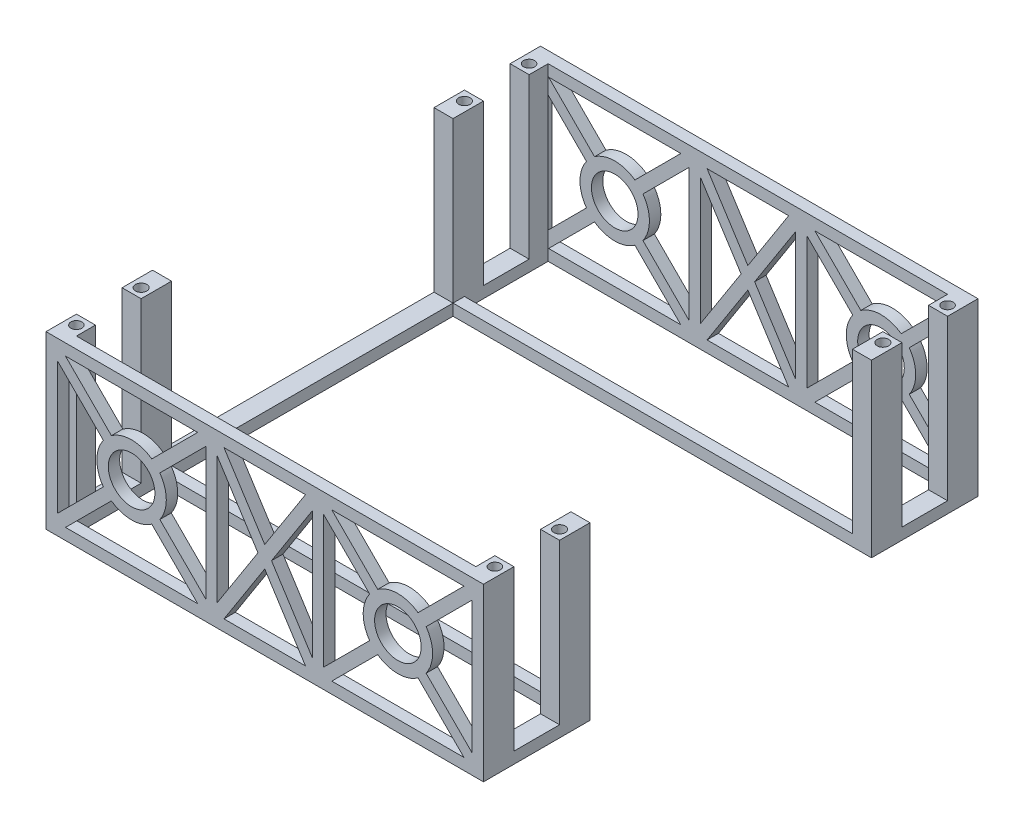
from build123d import *

# Parameters (mm, degrees)
SKETCH1_W           = 115
SKETCH1_H           = 45
SKETCH1_R           = 6.125
BOSS_EXTRUDE1_DEPTH = 3
SKETCH2_W           = 5
SKETCH2_H           = 45
BOSS_EXTRUDE2_DEPTH = 5
SKETCH3_R           = 1.45
CUT_EXTRUDE1_DEPTH  = 97.276078541
SKETCH4_W           = 5
SKETCH4_H           = 3
BOSS_EXTRUDE3_DEPTH = 122
BOSS_EXTRUDE5_DEPTH = 3
SKETCH8_W           = 5
SKETCH8_H           = 3
BOSS_EXTRUDE6_DEPTH = 12
SKETCH9_W           = 5
SKETCH9_H           = 3
BOSS_EXTRUDE7_DEPTH = 12
SKETCH10_W          = 5
SKETCH10_H          = 3
SKETCH10_H_2        = 5
BOSS_EXTRUDE8_DEPTH = 41.999995
SKETCH13_R          = 1.5
CUT_EXTRUDE3_DEPTH  = 160.289306921


with BuildPart() as part:
    # Sketch1 → Boss-Extrude1 (new body)
    with BuildSketch(Plane.XY):
        with Locations((-27.46518875, -74.528475384)):
            Rectangle(SKETCH1_W, SKETCH1_H)
        Polygon((-16.746917184, -94.028475384), (-38.183460316, -94.028475384), (-27.46518875, -77.307971742), align=None, mode=Mode.SUBTRACT)
        Polygon((-14.96518875, -57.807971742), (-14.96518875, -91.248979027), (-25.683460316, -74.528475384), align=None, mode=Mode.SUBTRACT)
        Polygon((-38.183460316, -55.028475384), (-16.746917184, -55.028475384), (-27.46518875, -71.748979027), align=None, mode=Mode.SUBTRACT)
        Polygon((-39.96518875, -91.248979027), (-39.96518875, -57.807971742), (-29.246917184, -74.528475384), align=None, mode=Mode.SUBTRACT)
        with BuildLine():
            Line((-11.96518875, -91.907155041), (-11.96518875, -57.149795728))
            Line((-11.96518875, -57.149795728), (0.109576269, -69.224560747))
            ThreePointArc((0.109576269, -69.224560747), (-1.59018875, -74.528475384), (0.109576269, -79.832390022))
            Line((0.109576269, -79.832390022), (-11.96518875, -91.907155041))
        make_face(mode=Mode.SUBTRACT)
        with BuildLine():
            Line((-9.843868406, -55.028475384), (24.913490906, -55.028475384))
            Line((24.913490906, -55.028475384), (12.838725887, -67.103240403))
            ThreePointArc((12.838725887, -67.103240403), (7.53481125, -65.403475384), (2.230896613, -67.103240403))
            Line((2.230896613, -67.103240403), (-9.843868406, -55.028475384))
        make_face(mode=Mode.SUBTRACT)
        with BuildLine():
            Line((27.03481125, -57.149795728), (27.03481125, -91.907155041))
            Line((27.03481125, -91.907155041), (14.960046231, -79.832390022))
            ThreePointArc((14.960046231, -79.832390022), (16.65981125, -74.528475384), (14.960046231, -69.224560747))
            Line((14.960046231, -69.224560747), (27.03481125, -57.149795728))
        make_face(mode=Mode.SUBTRACT)
        with BuildLine():
            Line((12.838725887, -81.953710365), (24.913490906, -94.028475384))
            Line((24.913490906, -94.028475384), (-9.843868406, -94.028475384))
            Line((-9.843868406, -94.028475384), (2.230896613, -81.953710365))
            ThreePointArc((2.230896613, -81.953710365), (7.53481125, -83.653475384), (12.838725887, -81.953710365))
        make_face(mode=Mode.SUBTRACT)
        with BuildLine():
            Line((-81.96518875, -91.907155041), (-81.96518875, -57.149795728))
            Line((-81.96518875, -57.149795728), (-69.890423731, -69.224560747))
            ThreePointArc((-69.890423731, -69.224560747), (-71.59018875, -74.528475384), (-69.890423731, -79.832390022))
            Line((-69.890423731, -79.832390022), (-81.96518875, -91.907155041))
        make_face(mode=Mode.SUBTRACT)
        with BuildLine():
            Line((-79.843868406, -55.028475384), (-45.086509094, -55.028475384))
            Line((-45.086509094, -55.028475384), (-57.161274113, -67.103240403))
            ThreePointArc((-57.161274113, -67.103240403), (-62.46518875, -65.403475384), (-67.769103387, -67.103240403))
            Line((-67.769103387, -67.103240403), (-79.843868406, -55.028475384))
        make_face(mode=Mode.SUBTRACT)
        with BuildLine():
            Line((-42.96518875, -57.149795728), (-42.96518875, -91.907155041))
            Line((-42.96518875, -91.907155041), (-55.039953769, -79.832390022))
            ThreePointArc((-55.039953769, -79.832390022), (-53.34018875, -74.528475384), (-55.039953769, -69.224560747))
            Line((-55.039953769, -69.224560747), (-42.96518875, -57.149795728))
        make_face(mode=Mode.SUBTRACT)
        with BuildLine():
            Line((-45.086509094, -94.028475384), (-79.843868406, -94.028475384))
            Line((-79.843868406, -94.028475384), (-67.769103387, -81.953710365))
            ThreePointArc((-67.769103387, -81.953710365), (-62.46518875, -83.653475384), (-57.161274113, -81.953710365))
            Line((-57.161274113, -81.953710365), (-45.086509094, -94.028475384))
        make_face(mode=Mode.SUBTRACT)
        with Locations((-62.46518875, -74.528475384)):
            Circle(SKETCH1_R, mode=Mode.SUBTRACT)
        with Locations((7.53481125, -74.528475384)):
            Circle(SKETCH1_R, mode=Mode.SUBTRACT)
    boss_extrude1 = extrude(amount=BOSS_EXTRUDE1_DEPTH)

    # Sketch2 → Boss-Extrude2 (add)
    with BuildSketch(Plane(origin=(0, 0, 0), x_dir=(-1, 0, 0), z_dir=(0, 0, -1))):
        with Locations((-27.53481125, -74.528475384)):
            Rectangle(SKETCH2_W, SKETCH2_H)
        with Locations((82.46518875, -74.528475384)):
            Rectangle(SKETCH2_W, SKETCH2_H)
    boss_extrude2 = extrude(amount=BOSS_EXTRUDE2_DEPTH)

    # Sketch3 → Cut-Extrude1 (cut, through all)
    with BuildSketch(Plane(origin=(0, -52.028475384, 0), x_dir=(1, 0, 0), z_dir=(0, 1, 0))):
        with Locations(Location((-82.46518875, 2.5, 0), (0, 0, 180))):
            Circle(SKETCH3_R)
        with Locations(Location((27.53481125, 2.5, 0), (0, 0, 180))):
            Circle(SKETCH3_R)
    cut_extrude1 = extrude(amount=-CUT_EXTRUDE1_DEPTH, mode=Mode.SUBTRACT)

    # Sketch4 → Boss-Extrude3 (add)
    with BuildSketch(Plane(origin=(0, 0, -5), x_dir=(-1, 0, 0), z_dir=(0, 0, -1))):
        with Locations((82.46518875, -95.528475384)):
            Rectangle(SKETCH4_W, SKETCH4_H)
    extrude(amount=BOSS_EXTRUDE3_DEPTH)

    # Mirror3: Boss-Extrude1, Boss-Extrude2, Cut-Extrude1 across plane
    add(boss_extrude1.mirror(Plane(origin=(0, 0, -62), x_dir=(1, 0, 0), z_dir=(0, 0, -1))))
    add(boss_extrude2.mirror(Plane(origin=(0, 0, -62), x_dir=(1, 0, 0), z_dir=(0, 0, -1))))
    add(cut_extrude1.mirror(Plane(origin=(0, 0, -62), x_dir=(1, 0, 0), z_dir=(0, 0, -1))), mode=Mode.SUBTRACT)

    # Sketch7 → Boss-Extrude5 (add)
    with BuildSketch(Plane(origin=(0, -97.028475384, 0), x_dir=(-1, 0, 0), z_dir=(0, -1, 0))):
        Polygon((-30.03481125, 25), (-30.03481125, 17), (-25.03481125, 17), (-25.03481125, 22), (79.96518875, 22), (79.96518875, 17), (84.96518875, 17), (84.96518875, 25), align=None)
        Polygon((79.96518875, 107), (79.96518875, 102), (-25.03481125, 102), (-25.03481125, 107), (-30.03481125, 107), (-30.03481125, 99), (84.96518875, 99), (84.96518875, 107), align=None)
    extrude(amount=-BOSS_EXTRUDE5_DEPTH)

    # Sketch8 → Boss-Extrude6 (add)
    with BuildSketch(Plane.XY.offset(-17)):
        with Locations((27.53481125, -95.528475384)):
            Rectangle(SKETCH8_W, SKETCH8_H)
    extrude(amount=BOSS_EXTRUDE6_DEPTH)

    # Sketch9 → Boss-Extrude7 (add)
    with BuildSketch(Plane(origin=(0, 0, -107), x_dir=(-1, 0, 0), z_dir=(0, 0, -1))):
        with Locations((-27.53481125, -95.528475384)):
            Rectangle(SKETCH9_W, SKETCH9_H)
    extrude(amount=BOSS_EXTRUDE7_DEPTH)

    # Sketch10 → Boss-Extrude8 (add)
    with BuildSketch(Plane(origin=(0, -94.028475384, 0), x_dir=(1, 0, 0), z_dir=(0, 1, 0))):
        with Locations((-82.46518875, 100.5)):
            Rectangle(SKETCH10_W, SKETCH10_H)
        with Locations((-82.46518875, 104.5)):
            Rectangle(SKETCH10_W, SKETCH10_H_2)
        with Locations((-82.46518875, 23.5)):
            Rectangle(SKETCH10_W, SKETCH10_H)
        with Locations((-82.46518875, 19.5)):
            Rectangle(SKETCH10_W, SKETCH10_H_2)
        with Locations((27.53481125, 23.5)):
            Rectangle(SKETCH10_W, SKETCH10_H)
        with Locations((27.53481125, 19.5)):
            Rectangle(SKETCH10_W, SKETCH10_H_2)
        with Locations((27.53481125, 104.5)):
            Rectangle(SKETCH10_W, SKETCH10_H_2)
        with Locations((27.53481125, 100.5)):
            Rectangle(SKETCH10_W, SKETCH10_H)
    extrude(amount=BOSS_EXTRUDE8_DEPTH)

    # Sketch13 → Cut-Extrude3 (cut, through all)
    with BuildSketch(Plane(origin=(0, -52.028475384, 0), x_dir=(1, 0, 0), z_dir=(0, 1, 0))):
        with Locations(Location((27.53481125, 19.5, 0), (0, 0, 270))):
            Circle(SKETCH13_R)
        with Locations(Location((27.53481125, 104.5, 0), (0, 0, 270))):
            Circle(SKETCH13_R)
        with Locations(Location((-82.46518875, 104.5, 0), (0, 0, 270))):
            Circle(SKETCH13_R)
        with Locations(Location((-82.46518875, 19.5, 0), (0, 0, 270))):
            Circle(SKETCH13_R)
    extrude(amount=-CUT_EXTRUDE3_DEPTH, mode=Mode.SUBTRACT)


solid = part.part
